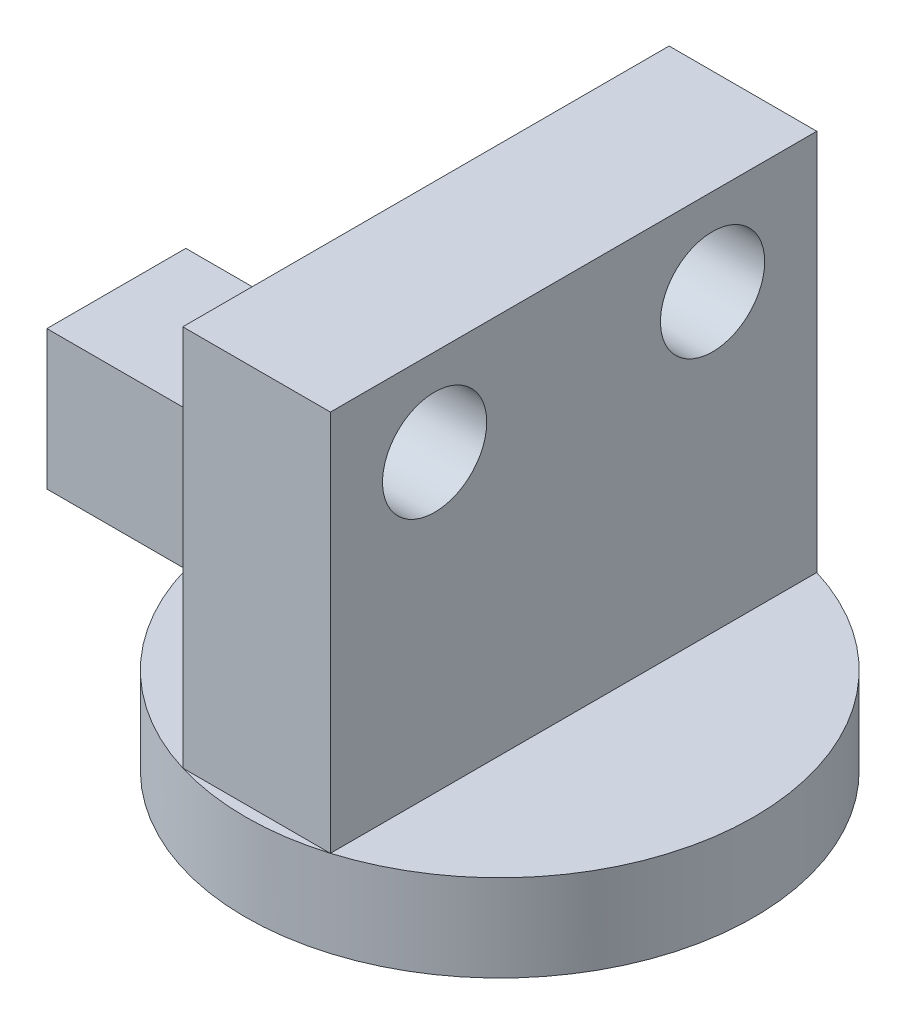
from build123d import *

# Parameters (mm, degrees)
SKETCH1_W           = 355.6
SKETCH1_H           = 215.9
SKETCH1_R           = 38.1
BOSS_EXTRUDE1_DEPTH = 53.975
SKETCH4_W           = 107.95
SKETCH4_H           = 355.6
BOSS_EXTRUDE4_DEPTH = 63.5
SKETCH2_W           = 107.95
SKETCH2_H           = 355.6
BOSS_EXTRUDE5_DEPTH = 63.5
SKETCH3_W           = 101.6
SKETCH3_H           = 101.6
BOSS_EXTRUDE3_DEPTH = 101.6
SKETCH5_W           = 101.6
SKETCH5_H           = 101.6
BOSS_EXTRUDE6_DEPTH = 101.6


with BuildPart() as part:
    # Sketch1 → Boss-Extrude1 (new, symmetric)
    with BuildSketch(Plane(origin=(0, 0, 0), x_dir=(0, 0, -1), z_dir=(1, 0, 0))):
        Rectangle(SKETCH1_W, SKETCH1_H)
        with Locations((-101.6, 44.45)):
            Circle(SKETCH1_R, mode=Mode.SUBTRACT)
        with Locations((101.6, 44.45)):
            Circle(SKETCH1_R, mode=Mode.SUBTRACT)
    extrude(amount=BOSS_EXTRUDE1_DEPTH, both=True)

    # Sketch4 → Boss-Extrude4 (add)
    with BuildSketch(Plane.XZ.offset(107.95)):
        Rectangle(SKETCH4_W, SKETCH4_H)
    extrude(amount=BOSS_EXTRUDE4_DEPTH)

    # Sketch2 → Boss-Extrude5 (add)
    with BuildSketch(Plane.XZ.offset(171.45)):
        with BuildLine():
            Line((-53.975, -177.8), (-53.975, 177.8))
            ThreePointArc((-53.975, 177.8), (-185.812111083, 0), (-53.975, -177.8))
        make_face()
        Rectangle(SKETCH2_W, SKETCH2_H)
        with BuildLine():
            ThreePointArc((185.812111083, 0), (149.257075746, 110.672787824), (53.975, 177.8))
            Line((53.975, 177.8), (53.975, -177.8))
            ThreePointArc((53.975, -177.8), (149.257075746, -110.672787824), (185.812111083, 0))
        make_face()
        with BuildLine():
            ThreePointArc((-53.975, -177.8), (0, -185.812111083), (53.975, -177.8))
            Line((53.975, -177.8), (-53.975, -177.8))
        make_face()
        with BuildLine():
            Line((-53.975, 177.8), (53.975, 177.8))
            ThreePointArc((53.975, 177.8), (0, 185.812111083), (-53.975, 177.8))
        make_face()
    extrude(amount=BOSS_EXTRUDE5_DEPTH)

    # Sketch3 → Boss-Extrude3 (add)
    with BuildSketch(Plane(origin=(0, -171.45, 0), x_dir=(1, 0, 0), z_dir=(0, 1, 0))):
        with Locations((-127.933042902, 0)):
            Rectangle(SKETCH3_W, SKETCH3_H)
    extrude(amount=BOSS_EXTRUDE3_DEPTH)

    # Sketch5 → Boss-Extrude6 (add)
    with BuildSketch(Plane.ZY.offset(178.733042902)):
        with Locations((0, -120.65)):
            Rectangle(SKETCH5_W, SKETCH5_H)
    extrude(amount=BOSS_EXTRUDE6_DEPTH)


solid = part.part
